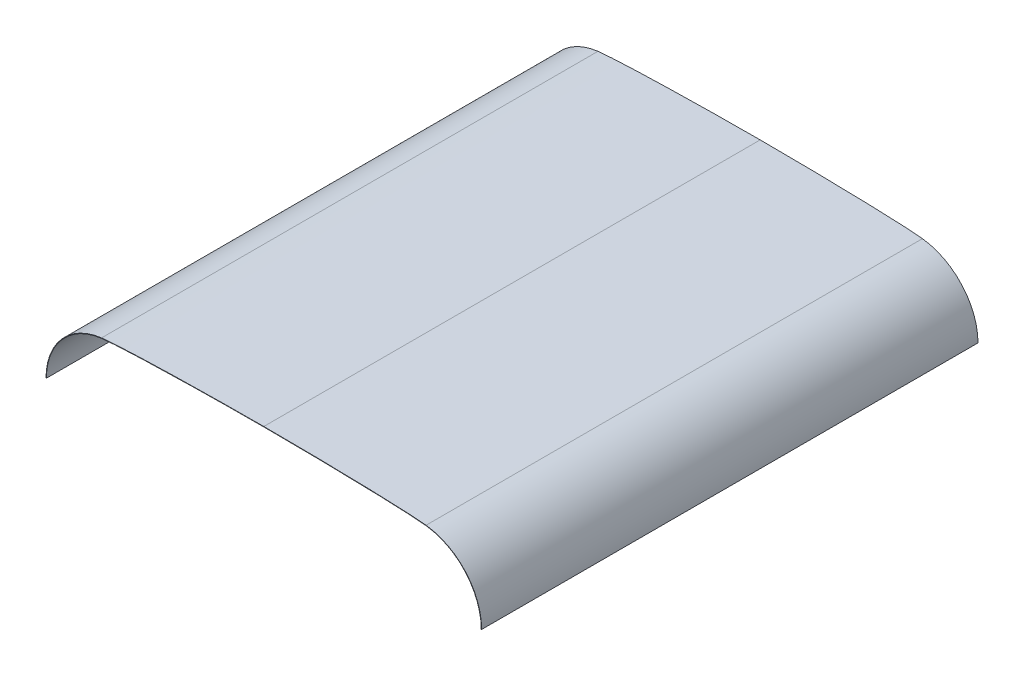
from build123d import *

# Parameters (mm, degrees)
SURFACE_EXTRUDE1_1_DEPTH = 2500
THICKEN1_T1              = 2


with BuildPart() as body_1:
    # Surface-Extrude1: a surface, the sketch's curves swept straight by 2500 mm
    with BuildLine(Plane.XY, mode=Mode.PRIVATE) as surface_extrude1_1_path:
        ThreePointArc((0, 0), (79.571294669, 209.280492894), (278.084601309, 312.829431703))
        add(Edge.make_bspline(
            [(278.084601309, 312.829431703), (391.549280401, 326.218817232), (812.489449679, 335), (1095, 335)],
            knots=[0, 0, 0, 0, 1, 1, 1, 1], degree=3))
        add(Edge.make_bspline(
            [(1095, 335), (1377.510550321, 335), (1798.450719599, 326.218817232), (1911.915398691, 312.829431703)],
            knots=[0, 0, 0, 0, 1, 1, 1, 1], degree=3))
        ThreePointArc((1911.915398691, 312.829431703), (2110.428705331, 209.280492894), (2190, 0))
    surface_extrude1_1 = Shell.extrude(surface_extrude1_1_path.wire(), (0 * SURFACE_EXTRUDE1_1_DEPTH, 0 * SURFACE_EXTRUDE1_1_DEPTH, 1 * SURFACE_EXTRUDE1_1_DEPTH))
    add(Solid.thicken(surface_extrude1_1, THICKEN1_T1))


solid = body_1.part
